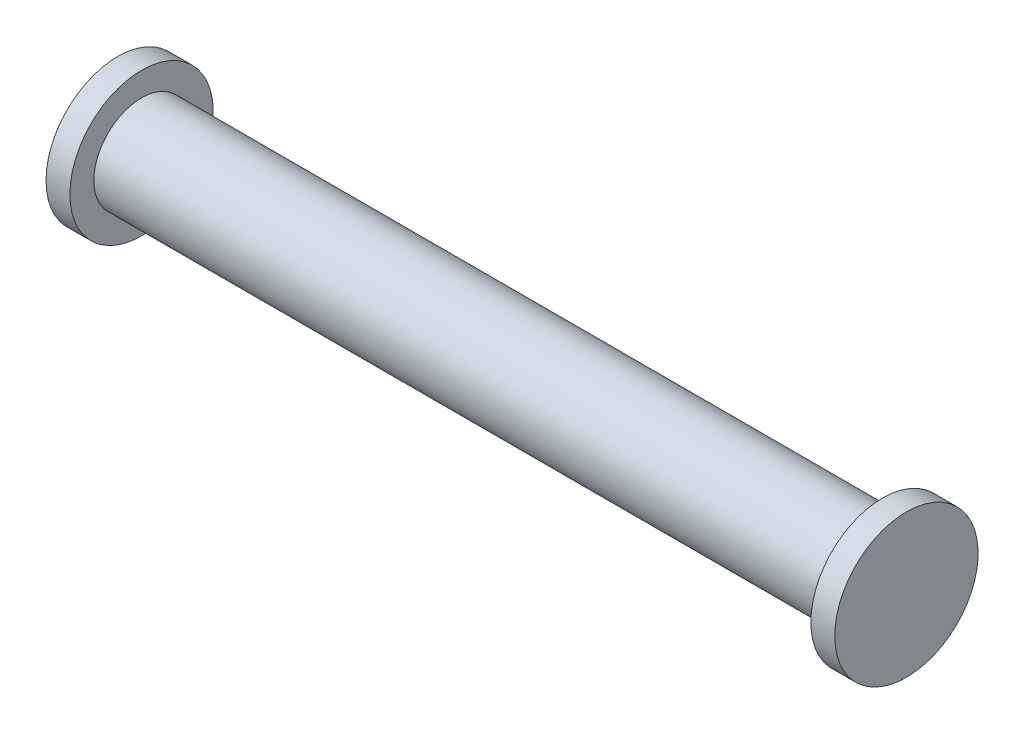
from build123d import *


with BuildPart() as part:
    # Sketch1 → Pasador_codo (revolve)
    with BuildSketch(Plane.XY, mode=Mode.PRIVATE) as pasador_codo_sk:
        Polygon((-14, 0), (-14, 4.5), (-12.5, 4.5), (-12.5, 3), (34, 3), (34, 4.5), (35.5, 4.5), (35.5, 0), align=None)
    revolve(pasador_codo_sk.sketch.rotate(Axis((-18, 0, 0), (1, 0, 0)), 90), axis=Axis((-18, 0, 0), (1, 0, 0)))


solid = part.part
